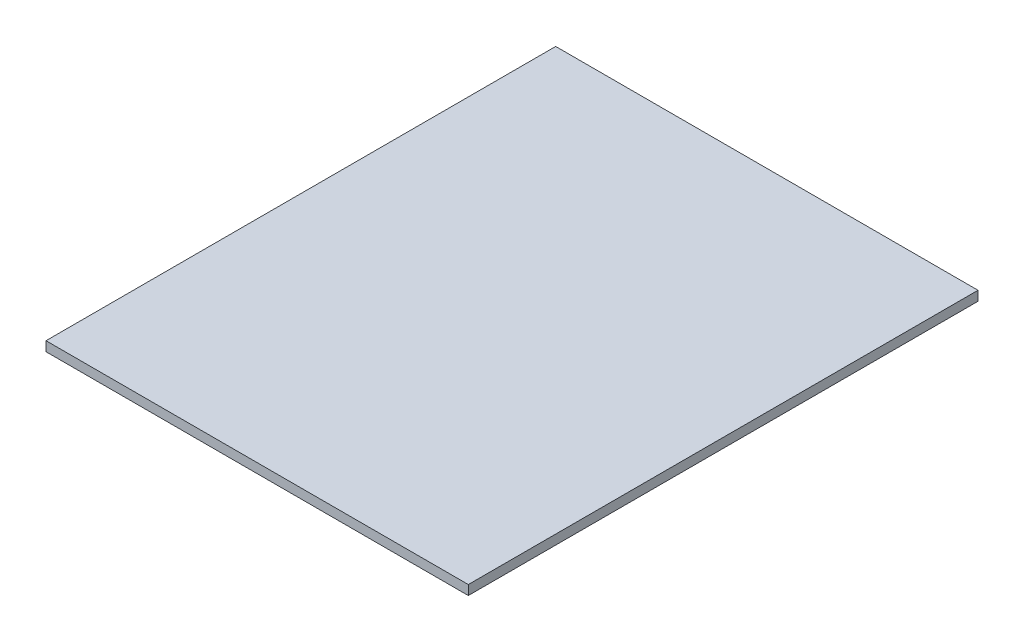
from build123d import *

# Parameters (mm, degrees)
SKETCH1_W           = 44.196
SKETCH1_H           = 53.34
BOSS_EXTRUDE1_DEPTH = 0.999998


with BuildPart() as part:
    # Sketch1 → Boss-Extrude1 (new body)
    with BuildSketch(Plane(origin=(0, 0, 0), x_dir=(1, 0, 0), z_dir=(0, 1, 0))):
        with Locations((-0.116612137, -12.822308707)):
            Rectangle(SKETCH1_W, SKETCH1_H)
    extrude(amount=BOSS_EXTRUDE1_DEPTH)


solid = part.part
